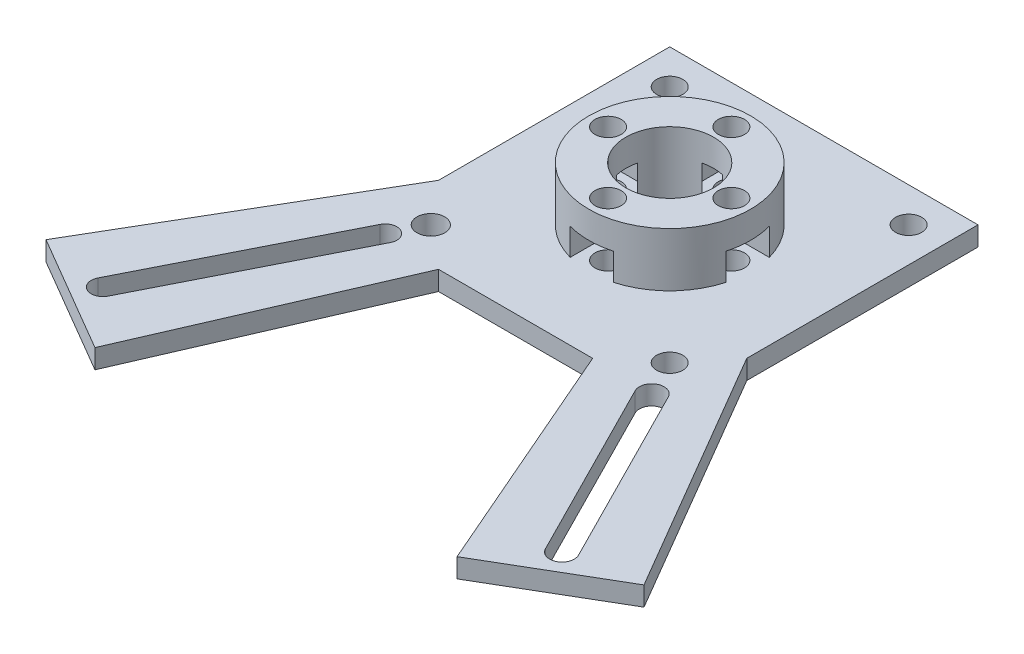
from build123d import *

# Parameters (mm, degrees)
SKETCH_1_R          = 1.7
SKETCH_1_R_2        = 1.8
SKETCH_1_R_3        = 5.7
EXTRUDE_1_DEPTH     = 2.5
SKETCH_2_R          = 10.5
EXTRUDE_2_DEPTH     = 7
SKETCH_4_R          = 1.7
CUT_EXTRUDE_1_DEPTH = 7
CUT_EXTRUDE_2_DEPTH = 3.5
SKETCH_6_R          = 5.7
CUT_EXTRUDE_3_DEPTH = 20


with BuildPart() as part:
    # 草图1 → 凸台-拉伸1 (new body)
    with BuildSketch(Plane(origin=(0, 0, 0), x_dir=(1, 0, 0), z_dir=(0, 1, 0))):
        Polygon((-9.99944515, -20.000324527), (10.00055485, -20.000324527), (23.493176713, -51.085714784), (38.795982487, -42.134997854), (20, -10), (20, 20), (-20, 20), (-20, -10), (-38.79573581, -42.1354119), (-23.493239928, -51.085714784), align=None)
        with Locations(Location((15.5, 15.5, 0), (0, 0, 270))):
            Circle(SKETCH_1_R, mode=Mode.SUBTRACT)
        with Locations(Location((-15.5, -15.5, 0), (0, 0, 270))):
            Circle(SKETCH_1_R_2, mode=Mode.SUBTRACT)
        with Locations(Location((-15.5, 15.5, 0), (0, 0, 270))):
            Circle(SKETCH_1_R, mode=Mode.SUBTRACT)
        with Locations(Location((0, 0, 0), (0, 0, 270))):
            Circle(SKETCH_1_R_3, mode=Mode.SUBTRACT)
        with Locations(Location((-8, 0, 0), (0, 0, 270))):
            Circle(SKETCH_1_R, mode=Mode.SUBTRACT)
        with Locations(Location((0, 8, 0), (0, 0, 270))):
            Circle(SKETCH_1_R, mode=Mode.SUBTRACT)
        with Locations(Location((8, 0, 0), (0, 0, 270))):
            Circle(SKETCH_1_R, mode=Mode.SUBTRACT)
        with Locations(Location((0, -8, 0), (0, 0, 270))):
            Circle(SKETCH_1_R, mode=Mode.SUBTRACT)
        with Locations(Location((15.5, -15.5, 0), (0, 0, 270))):
            Circle(SKETCH_1_R, mode=Mode.SUBTRACT)
        with BuildLine():
            Line((-16.131862345, -20.121977189), (-28.419219954, -44.445930008))
            ThreePointArc((-28.419219954, -44.445930008), (-30.461319047, -45.117305053), (-31.132694091, -43.07520596))
            Line((-31.132694091, -43.07520596), (-18.845336482, -18.75125314))
            ThreePointArc((-18.845336482, -18.75125314), (-16.803237389, -18.079878096), (-16.131862345, -20.121977189))
        make_face(mode=Mode.SUBTRACT)
        with BuildLine():
            Line((19.251434516, -19.436615165), (31.203359651, -43.037711333))
            ThreePointArc((31.203359651, -43.037711333), (30.498813674, -45.187970612), (28.348554395, -44.483424635))
            Line((28.348554395, -44.483424635), (16.39662926, -20.882328467))
            ThreePointArc((16.39662926, -20.882328467), (17.101175237, -18.732069188), (19.251434516, -19.436615165))
        make_face(mode=Mode.SUBTRACT)
    extrude(amount=EXTRUDE_1_DEPTH)

    # 草图2 → 凸台-拉伸2 (add)
    with BuildSketch(Plane(origin=(0, 2.5, 0), x_dir=(1, 0, 0), z_dir=(0, 1, 0))):
        with Locations(Location((0, 0, 0), (0, 0, 270))):
            Circle(SKETCH_2_R)
    extrude(amount=EXTRUDE_2_DEPTH)

    # 草图4 → 切除-拉伸1 (cut)
    with BuildSketch(Plane.XZ.offset(-2.5)):
        with Locations(Location((0, -8, 0), (0, 0, 270))):
            Circle(SKETCH_4_R)
        with Locations(Location((-8, 0, 0), (0, 0, 270))):
            Circle(SKETCH_4_R)
        with Locations(Location((8, 0, 0), (0, 0, 270))):
            Circle(SKETCH_4_R)
        with Locations(Location((0, 8, 0), (0, 0, 270))):
            Circle(SKETCH_4_R)
    extrude(amount=-CUT_EXTRUDE_1_DEPTH, mode=Mode.SUBTRACT)

    # 草图5 → 切除-拉伸2 (cut)
    with BuildSketch(Plane(origin=(0, 2.5, 0), x_dir=(1, 0, 0), z_dir=(0, 1, 0))):
        Polygon((-4.766838493, 0), (-6.383419246, 2.8), (-11.233161507, 2.8), (-11.233161507, -2.8), (-6.383419246, -2.8), align=None)
        Polygon((4.766838493, 0), (6.383419246, -2.8), (11.233161507, -2.8), (11.233161507, 2.8), (6.383419246, 2.8), align=None)
        Polygon((-2.8, 11.233161507), (-2.8, 6.383419246), (0, 4.766838493), (2.8, 6.383419246), (2.8, 11.233161507), align=None)
        Polygon((0, -4.766838493), (-2.8, -6.383419246), (-2.8, -11.233161507), (2.8, -11.233161507), (2.8, -6.383419246), align=None)
    extrude(amount=CUT_EXTRUDE_2_DEPTH, mode=Mode.SUBTRACT)

    # 草图6 → 切除-拉伸3 (cut)
    with BuildSketch(Plane.XZ.offset(-2.5)):
        with Locations(Location((0, 0, 0), (0, 0, 90))):
            Circle(SKETCH_6_R)
    extrude(amount=-CUT_EXTRUDE_3_DEPTH, mode=Mode.SUBTRACT)


solid = part.part
